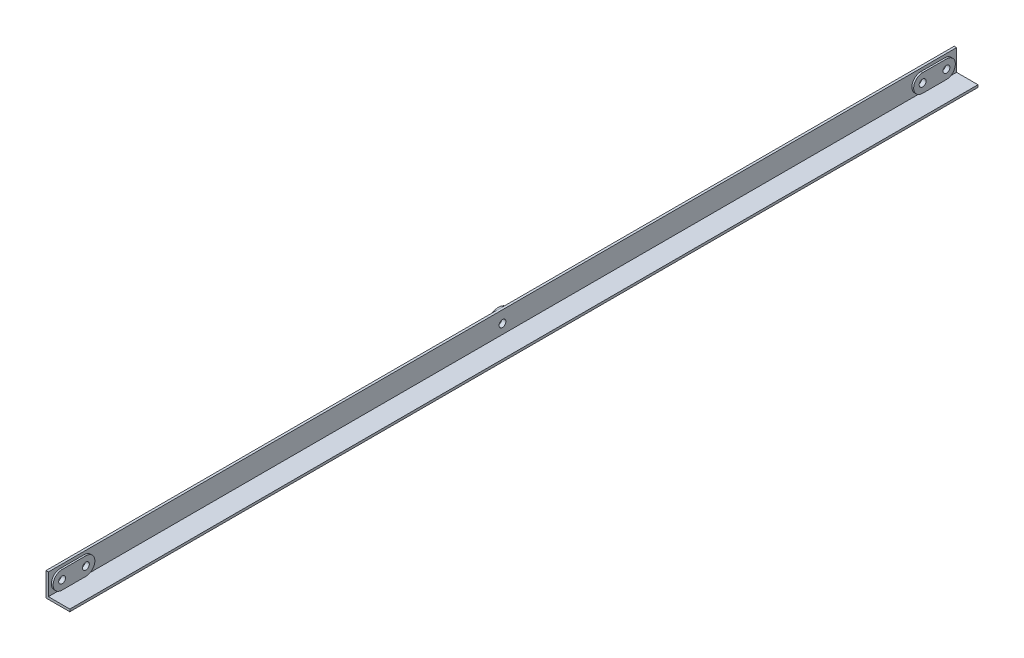
from build123d import *

# Parameters (mm, degrees)
SKETCH_1_W          = 80
SKETCH_1_H          = 80
EXTRUDE_1_DEPTH     = 3050
SKETCH_2_W          = 72
SKETCH_2_H          = 72
CUT_EXTRUDE_1_DEPTH = 3053.097639329
SKETCH_5_R          = 40
EXTRUDE_2_DEPTH     = 6
SKETCH_6_R          = 11.5
CUT_EXTRUDE_2_DEPTH = 3053.260801439
SKETCH_7_R          = 30
EXTRUDE_3_DEPTH     = 6
SKETCH_8_W          = 80
SKETCH_8_H          = 60
EXTRUDE_4_DEPTH     = 6
SKETCH_9_R          = 11.5
CUT_EXTRUDE_3_DEPTH = 3053.097639329


with BuildPart() as part:
    # 草图1 → 凸台-拉伸1 (new body)
    with BuildSketch(Plane.XY):
        with Locations((40, 40)):
            Rectangle(SKETCH_1_W, SKETCH_1_H)
    extrude(amount=EXTRUDE_1_DEPTH)

    # 草图2 → 切除-拉伸1 (cut, through all)
    with BuildSketch(Plane.XY.offset(3050)):
        with Locations((44, 44)):
            Rectangle(SKETCH_2_W, SKETCH_2_H)
    extrude(amount=-CUT_EXTRUDE_1_DEPTH, mode=Mode.SUBTRACT)

    # 草图5 → 凸台-拉伸2 (add)
    with BuildSketch(Plane.ZY):
        with Locations(Location((1525, 40, 0), (0, 0, 270))):
            Circle(SKETCH_5_R)
    extrude(amount=EXTRUDE_2_DEPTH)

    # 草图6 → 切除-拉伸2 (cut, through all)
    with BuildSketch(Plane.ZY.offset(6)):
        with Locations((1525, 40)):
            Circle(SKETCH_6_R)
    extrude(amount=-CUT_EXTRUDE_2_DEPTH, mode=Mode.SUBTRACT)

    # 草图7 → 凸台-拉伸3 (add)
    with BuildSketch(Plane(origin=(8, 0, 0), x_dir=(0, 0, -1), z_dir=(1, 0, 0))):
        with Locations(Location((-3010, 40, 0), (0, 0, 270))):
            Circle(SKETCH_7_R)
        with Locations(Location((-2930, 40, 0), (0, 0, 270))):
            Circle(SKETCH_7_R)
    extrude_3 = extrude(amount=EXTRUDE_3_DEPTH)

    # 草图8 → 凸台-拉伸4 (add)
    with BuildSketch(Plane(origin=(8, 0, 0), x_dir=(0, 0, -1), z_dir=(1, 0, 0))):
        with Locations((-2970, 40)):
            Rectangle(SKETCH_8_W, SKETCH_8_H)
    extrude_4 = extrude(amount=EXTRUDE_4_DEPTH)

    # 草图9 → 切除-拉伸3 (cut, through all)
    with BuildSketch(Plane.ZY):
        with Locations((3010, 40)):
            Circle(SKETCH_9_R)
        with Locations((2930, 40)):
            Circle(SKETCH_9_R)
    cut_extrude_3 = extrude(amount=-CUT_EXTRUDE_3_DEPTH, mode=Mode.SUBTRACT)

    # 镜向1: 凸台-拉伸3, 凸台-拉伸4, 切除-拉伸3 across plane
    add(extrude_3.mirror(Plane.XY.offset(1525)))
    add(extrude_4.mirror(Plane.XY.offset(1525)))
    add(cut_extrude_3.mirror(Plane.XY.offset(1525)), mode=Mode.SUBTRACT)


solid = part.part
